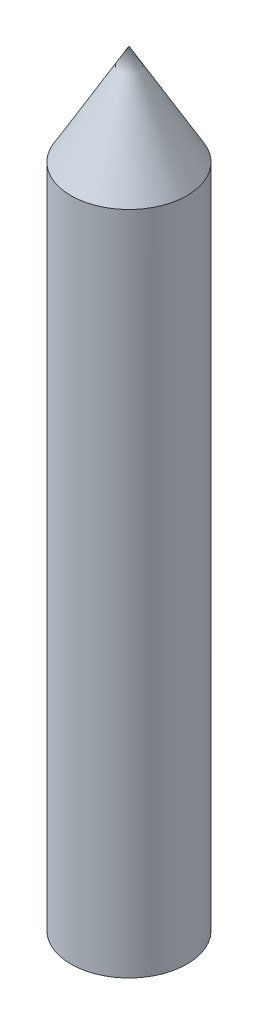
from build123d import *


with BuildPart() as part:
    # Sketch2 → Revolve1 (revolve)
    with BuildSketch(Plane.XY, mode=Mode.PRIVATE) as revolve1_sk:
        Polygon((0, 0), (0, 32), (2.425, 27.799776792), (2.425, 0), align=None)
    revolve(revolve1_sk.sketch.rotate(Axis((0, 0, 0), (0, -1, 0)), 270), axis=Axis((0, 0, 0), (0, -1, 0)))


solid = part.part
